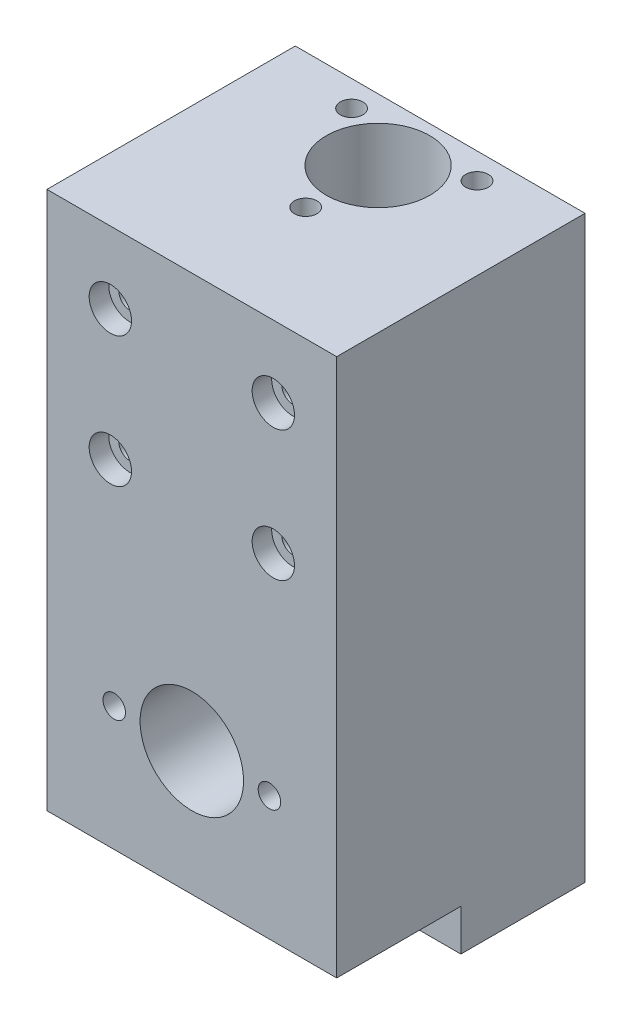
from build123d import *

# Parameters (mm, degrees)
SKETCH1_W                      = 44.45
SKETCH1_H                      = 38.1
BOSS_EXTRUDE1_DEPTH            = 88.9
SKETCH2_W                      = 44.45
SKETCH2_H                      = 6.35
CUT_EXTRUDE1_DEPTH             = 19.05
CUT_EXTRUDE2_REACH             = 95.595
SKETCH3_R                      = 7.9375
CIRPATTERN1_COUNT              = 3
LPATTERN1_COUNT                = 2
LPATTERN1_PITCH                = 9.525
LPATTERN1_COUNT_DIR2           = 2
LPATTERN1_PITCH_DIR2           = 34.925
CBORE_FOR_M3_SHCS1_D           = 3.4
CBORE_FOR_M3_SHCS1_CBORE_D     = 6.5
CBORE_FOR_M3_SHCS1_CBORE_DEPTH = 3
SKETCH11_R                     = 7.9375
CUT_EXTRUDE3_DEPTH             = 12.7
F_8_32_TAPPED_HOLE1_D          = 3.4544
F_8_32_TAPPED_HOLE1_DEPTH      = 19.05
F_8_32_TAPPED_HOLE1_TIP        = 1.037806461
LPATTERN2_COUNT                = 2
LPATTERN2_PITCH                = 25
LPATTERN2_COUNT_DIR2           = 2
LPATTERN2_PITCH_DIR2           = 20


with BuildPart() as part:
    # Sketch1 → Boss-Extrude1 (new body)
    with BuildSketch(Plane(origin=(0, 0, 0), x_dir=(1, 0, 0), z_dir=(0, 1, 0))):
        Rectangle(SKETCH1_W, SKETCH1_H)
    extrude(amount=BOSS_EXTRUDE1_DEPTH)

    # Sketch2 → Cut-Extrude1 (cut)
    with BuildSketch(Plane.XY.offset(19.05)):
        with Locations((0, 3.175)):
            Rectangle(SKETCH2_W, SKETCH2_H)
    extrude(amount=-CUT_EXTRUDE1_DEPTH, mode=Mode.SUBTRACT)

    # Sketch3 → Cut-Extrude2 (cut, up to next)
    with BuildSketch(Plane(origin=(0, 88.9, 0), x_dir=(1, 0, 0), z_dir=(0, 1, 0)), mode=Mode.PRIVATE) as cut_extrude2_sk1:
        with Locations(Location((0, 9.525, 0), (0, 0, 270))):
            Circle(SKETCH3_R)
    cut_extrude2_tool1 = extrude(cut_extrude2_sk1.sketch, amount=-CUT_EXTRUDE2_REACH, mode=Mode.PRIVATE) & part.part
    add(cut_extrude2_tool1.solids().sort_by_distance((0, 88.9, -9.525))[0], mode=Mode.SUBTRACT)

    # Sketch4 → #8-32 Tapped Hole2 (revolve, cut)
    with BuildSketch(Plane(origin=(0, 88.9, 1.5875), x_dir=(0, 0, 1), z_dir=(1, 0, 0))):
        Polygon((0, 0), (0, 13.737806461), (1.7272, 12.7), (1.7272, 0), align=None)
    f_8_32_tapped_hole2 = revolve(axis=Axis((0, 95.25, 1.5875), (0, -1, 0)), mode=Mode.SUBTRACT)

    # CirPattern1: #8-32 Tapped Hole2 ×3 about axis
    cirpattern1_axis = Axis((0, 0, -9.525), (0, 1, 0))
    for i in range(1, CIRPATTERN1_COUNT):
        add(f_8_32_tapped_hole2.rotate(cirpattern1_axis, i * 360 / CIRPATTERN1_COUNT), mode=Mode.SUBTRACT)

    # Sketch6 → #6-32 Tapped Hole1 (revolve, cut)
    with BuildSketch(Plane(origin=(-17.4625, 6.35, 14.2875), x_dir=(0, 0, -1), z_dir=(1, 0, 0))):
        Polygon((0, 0), (0, 18.59269403), (1.35255, 17.78), (1.35255, 0), align=None)
    f_6_32_tapped_hole1 = revolve(axis=Axis((-17.4625, 0, 14.2875), (0, 1, 0)), mode=Mode.SUBTRACT)

    # LPattern1: 6-32 Tapped Hole1 2 × 2
    with Locations(*[(j * LPATTERN1_PITCH_DIR2, 0, -i * LPATTERN1_PITCH) for i in range(LPATTERN1_COUNT) for j in range(LPATTERN1_COUNT_DIR2) if (i, j) != (0, 0)]):
        add(f_6_32_tapped_hole1, mode=Mode.SUBTRACT)

    # CBORE for M3 SHCS1 (through all)
    with Locations(Plane.XY.offset(19.05)):
        with Locations((-12.5, 77.9)):
            cbore_for_m3_shcs1 = CounterBoreHole(CBORE_FOR_M3_SHCS1_D / 2, CBORE_FOR_M3_SHCS1_CBORE_D / 2, CBORE_FOR_M3_SHCS1_CBORE_DEPTH)

    # Sketch11 → Cut-Extrude3 (cut)
    with BuildSketch(Plane.XY.offset(19.05)):
        with Locations((0, 25.4)):
            Circle(SKETCH11_R)
    extrude(amount=-CUT_EXTRUDE3_DEPTH, mode=Mode.SUBTRACT)

    # #8-32 Tapped Hole1
    with Locations(Plane.XY.offset(19.05)):
        with Locations((-11.90625, 25.4), (11.90625, 25.4)):
            Hole(F_8_32_TAPPED_HOLE1_D / 2, depth=F_8_32_TAPPED_HOLE1_DEPTH)
            with Locations((0, 0, -(F_8_32_TAPPED_HOLE1_DEPTH + F_8_32_TAPPED_HOLE1_TIP / 2))):  # 118° drill point
                Cone(0, F_8_32_TAPPED_HOLE1_D / 2, F_8_32_TAPPED_HOLE1_TIP, mode=Mode.SUBTRACT)

    # LPattern2: CBORE for M3 SHCS1 2 × 2
    with Locations(*[(i * LPATTERN2_PITCH, -j * LPATTERN2_PITCH_DIR2, 0) for i in range(LPATTERN2_COUNT) for j in range(LPATTERN2_COUNT_DIR2) if (i, j) != (0, 0)]):
        add(cbore_for_m3_shcs1, mode=Mode.SUBTRACT)


solid = part.part
